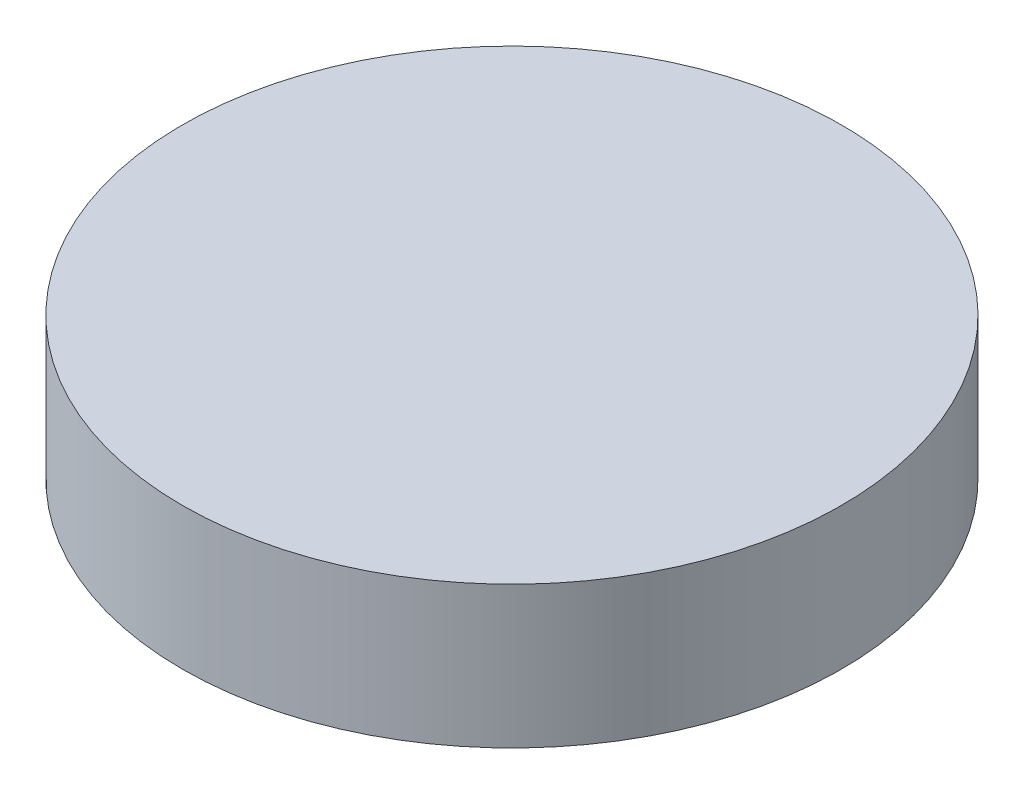
from build123d import *

# Parameters (mm, degrees)
SKETCH_1_R      = 39.5
EXTRUDE_1_DEPTH = 17


with BuildPart() as part:
    # 草图1 → 凸台-拉伸1 (new body)
    with BuildSketch(Plane(origin=(0, 0, 0), x_dir=(1, 0, 0), z_dir=(0, 1, 0))):
        with Locations(Location((0, 0, 0), (0, 0, 270))):
            Circle(SKETCH_1_R)
    extrude(amount=EXTRUDE_1_DEPTH)


solid = part.part
